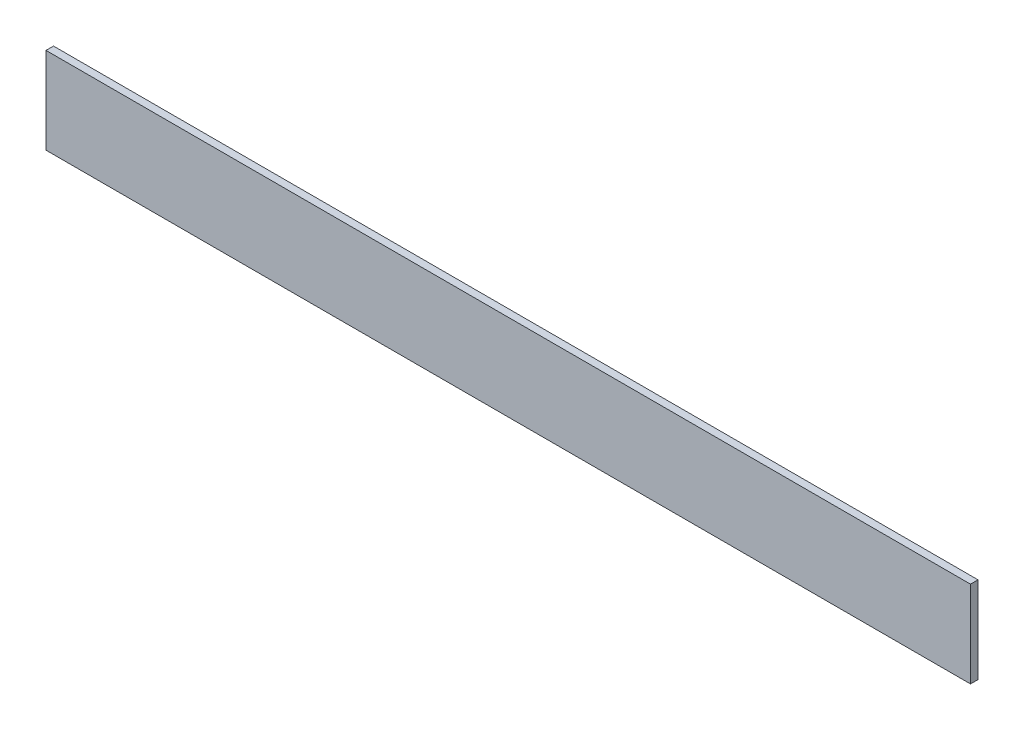
from build123d import *

# Parameters (mm, degrees)
SKETCH1_W           = 1230
SKETCH1_H           = 115
BOSS_EXTRUDE1_DEPTH = 10


with BuildPart() as part:
    # Sketch1 → Boss-Extrude1 (new body)
    with BuildSketch(Plane.XY):
        with Locations((615, 57.5)):
            Rectangle(SKETCH1_W, SKETCH1_H)
    extrude(amount=BOSS_EXTRUDE1_DEPTH)


solid = part.part
